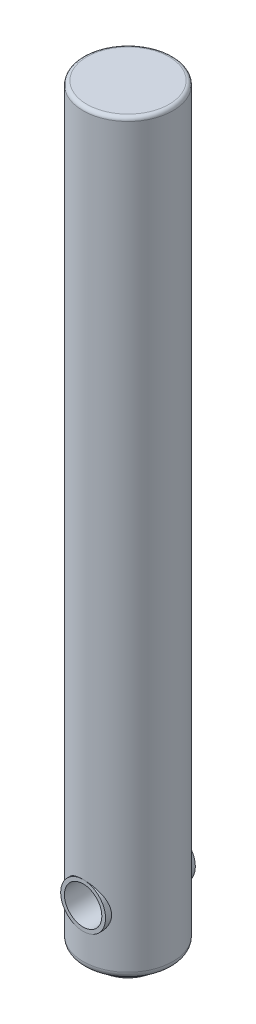
from build123d import *

# Parameters (mm, degrees)
SKETCH_1_R          = 12
EXTRUDE_1_DEPTH     = 200
EXTRUDE_START       = -24
SKETCH_2_R          = 6
EXTRUDE_2_DEPTH     = 24
CUT_EXTRUDE_1_REACH = 203.792
SKETCH_3_R          = 5
FILLET_1_R          = 2
FILLET_2_R          = 1
DOME_1_FACE_RADIUS  = 10
DOME_1_HEIGHT       = 5


with BuildPart() as part:
    # 스케치1 → 보스-돌출1 (new body)
    with BuildSketch(Plane(origin=(0, 0, 0), x_dir=(1, 0, 0), z_dir=(0, 1, 0))):
        with Locations(Location((0, 0, 0), (0, 0, 270))):
            Circle(SKETCH_1_R)
    extrude(amount=EXTRUDE_1_DEPTH)

    # 스케치2 → 보스-돌출2 (add)
    with BuildSketch(Plane.XY.offset(12).offset(EXTRUDE_START)):
        with Locations((0, 15)):
            Circle(SKETCH_2_R)
    extrude(amount=EXTRUDE_2_DEPTH)

    # 스케치3 → 컷-돌출1 (cut, up to next)
    with BuildSketch(Plane.XY.offset(12), mode=Mode.PRIVATE) as cut_extrude_1_sk1:
        with Locations((0, 15)):
            Circle(SKETCH_3_R)
    cut_extrude_1_tool1 = extrude(cut_extrude_1_sk1.sketch, amount=-CUT_EXTRUDE_1_REACH, mode=Mode.PRIVATE) & part.part
    add(cut_extrude_1_tool1.solids().sort_by_distance((0, 15, 12))[0], mode=Mode.SUBTRACT)

    # 필렛1
    fillet_1_edges = [part.edges().sort_by_distance(p)[0] for p in [
        (0, 0, -12),
    ]]
    fillet(fillet_1_edges, radius=FILLET_1_R)

    # 필렛2
    fillet_2_edges = [part.edges().sort_by_distance(p)[0] for p in [
        (0, 200, -12),
    ]]
    fillet(fillet_2_edges, radius=FILLET_2_R)

    # 돔1: a dome of height H over a round flat face of radius A is a cap of a sphere of radius (A * A + H * H) / (2 * H)
    dome_1_r = (DOME_1_FACE_RADIUS * DOME_1_FACE_RADIUS + DOME_1_HEIGHT * DOME_1_HEIGHT) / (2 * DOME_1_HEIGHT)
    dome_1_base = Plane((0, 0, 0), z_dir=(0, -1, 0))
    with Locations(dome_1_base.offset(DOME_1_HEIGHT - dome_1_r)):
        dome_1_ball = Sphere(dome_1_r, mode=Mode.PRIVATE)
    add(split(dome_1_ball, bisect_by=dome_1_base, keep=Keep.TOP, mode=Mode.PRIVATE))


solid = part.part
